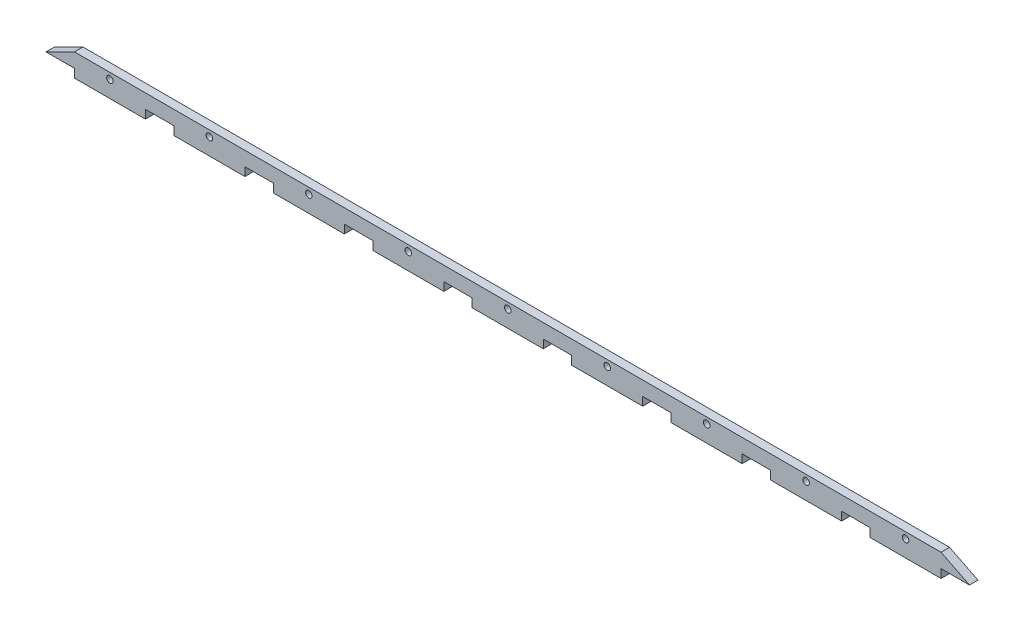
from build123d import *

# Parameters (mm, degrees)
EXTRUDE_1_DEPTH     = 3
SKETCH_2_R          = 1.15
CUT_EXTRUDE_1_DEPTH = 326.052303484


with BuildPart() as part:
    # 草图1 → 凸台-拉伸1 (new body)
    with BuildSketch(Plane.XY):
        Polygon((0, 0), (10, 5), (315, 5), (325, 0), (315, 0), (315, -3), (290, -3), (290, 0), (280, 0), (280, -3), (255, -3), (255, 0), (245, 0), (245, -3), (220, -3), (220, 0), (210, 0), (210, -3), (185, -3), (185, 0), (175, 0), (175, -3), (150, -3), (150, 0), (140, 0), (140, -3), (115, -3), (115, 0), (105, 0), (105, -3), (80, -3), (80, 0), (70, 0), (70, -3), (45, -3), (45, 0), (35, 0), (35, -3), (10, -3), (10, 0), align=None)
    extrude(amount=EXTRUDE_1_DEPTH)

    # 草图2 → 切除-拉伸1 (cut, through all)
    with BuildSketch(Plane.XY.offset(3)):
        with Locations((22.5, 2.85)):
            Circle(SKETCH_2_R)
        with Locations((57.5, 2.85)):
            Circle(SKETCH_2_R)
        with Locations((92.5, 2.85)):
            Circle(SKETCH_2_R)
        with Locations((127.5, 2.85)):
            Circle(SKETCH_2_R)
        with Locations((162.5, 2.85)):
            Circle(SKETCH_2_R)
        with Locations((197.5, 2.85)):
            Circle(SKETCH_2_R)
        with Locations((232.5, 2.85)):
            Circle(SKETCH_2_R)
        with Locations((267.5, 2.85)):
            Circle(SKETCH_2_R)
        with Locations((302.5, 2.85)):
            Circle(SKETCH_2_R)
    extrude(amount=-CUT_EXTRUDE_1_DEPTH, mode=Mode.SUBTRACT)


solid = part.part
